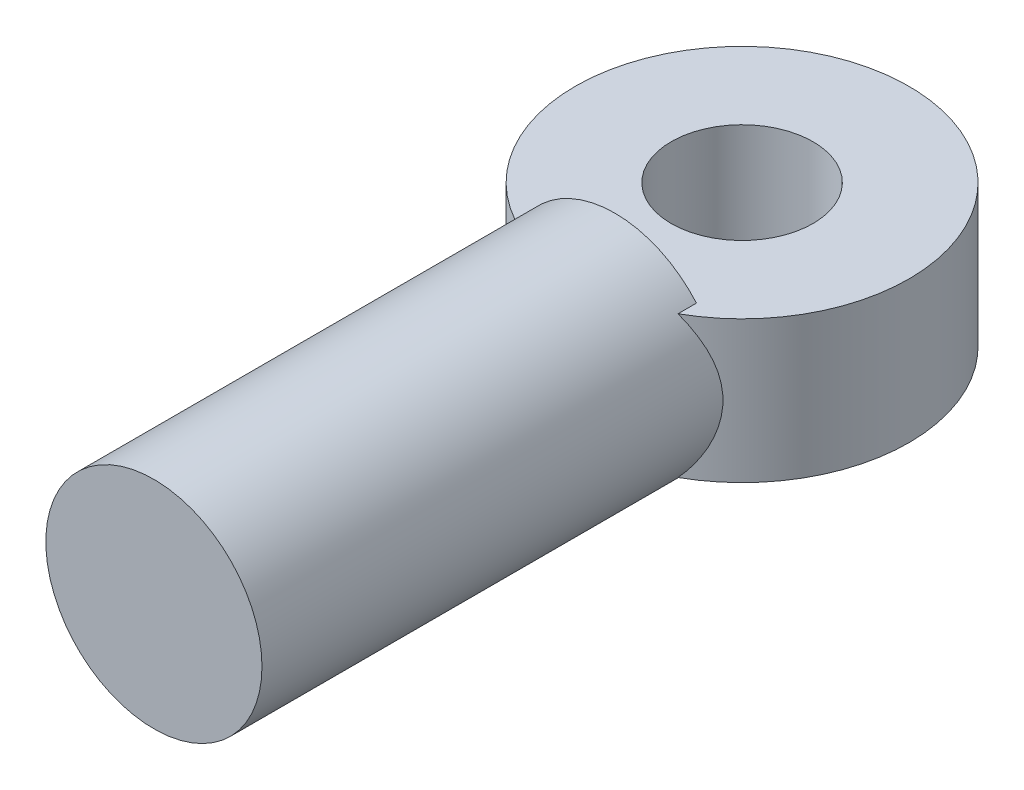
from build123d import *

# Parameters (mm, degrees)
SKETCH1_R           = 30.475
BOSS_EXTRUDE1_DEPTH = 130
SKETCH2_R           = 47.05874864
BOSS_EXTRUDE2_DEPTH = 20
SKETCH8_R           = 20
CUT_EXTRUDE1_DEPTH  = 40


with BuildPart() as part:
    # Sketch1 → Boss-Extrude1 (new body)
    with BuildSketch(Plane.XY):
        Circle(SKETCH1_R)
    extrude(amount=BOSS_EXTRUDE1_DEPTH)

    # Sketch2 → Boss-Extrude2 (add, symmetric)
    with BuildSketch(Plane(origin=(0, 0, 0), x_dir=(1, 0, 0), z_dir=(0, 1, 0))):
        with Locations((0, 35.858056257)):
            Circle(SKETCH2_R)
    extrude(amount=BOSS_EXTRUDE2_DEPTH, both=True)

    # Sketch8 → Cut-Extrude1 (cut)
    with BuildSketch(Plane(origin=(0, 20, 0), x_dir=(1, 0, 0), z_dir=(0, 1, 0))):
        with Locations(Location((0, 35.858056257, 0), (0, 0, 270))):
            Circle(SKETCH8_R)
    extrude(amount=-CUT_EXTRUDE1_DEPTH, mode=Mode.SUBTRACT)


solid = part.part
